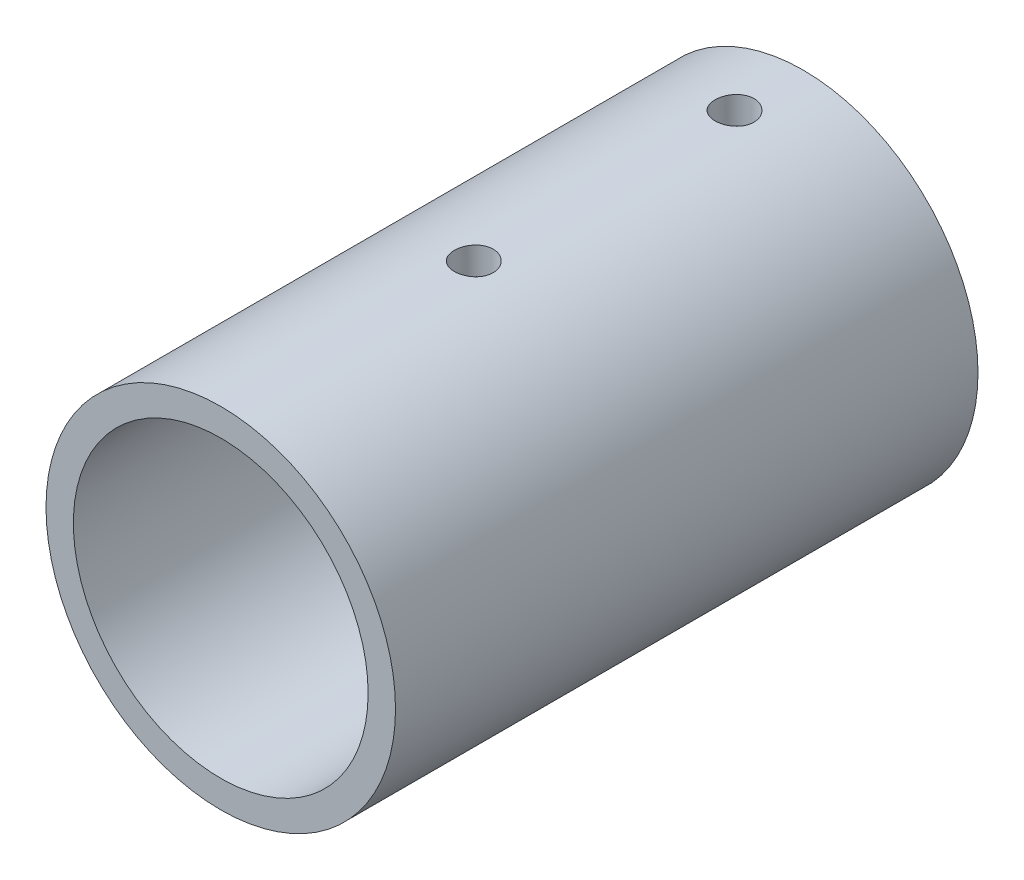
from build123d import *

# Parameters (mm, degrees)
SKETCH1_R               = 45
BOSS_EXTRUDE1_DEPTH     = 150
SKETCH2_R               = 31.85
CUT_EXTRUDE1_DEPTH      = 163.941707368
SKETCH3_R               = 37.95
CUT_EXTRUDE2_DEPTH      = 140
CUT_EXTRUDE5_DEPTH      = 163.941707368
CUT_EXTRUDE5_DEPTH_BACK = 163.941707368
SKETCH8_R               = 5


with BuildPart() as part:
    # Sketch1 → Boss-Extrude1 (new body)
    with BuildSketch(Plane.XY):
        Circle(SKETCH1_R)
    extrude(amount=BOSS_EXTRUDE1_DEPTH)

    # Sketch2 → Cut-Extrude1 (cut, through all)
    with BuildSketch(Plane.XY.offset(150)):
        Circle(SKETCH2_R)
    extrude(amount=-CUT_EXTRUDE1_DEPTH, mode=Mode.SUBTRACT)

    # Sketch3 → Cut-Extrude2 (cut)
    with BuildSketch(Plane.XY.offset(150)):
        Circle(SKETCH3_R)
    extrude(amount=-CUT_EXTRUDE2_DEPTH, mode=Mode.SUBTRACT)

    # Sketch8 → Cut-Extrude5 (cut, two sides: drawn at the far end of the back side and taken through both)
    with BuildSketch(Plane(origin=(0, 0, 0), x_dir=(1, 0, 0), z_dir=(0, 1, 0)).offset(-CUT_EXTRUDE5_DEPTH_BACK)):
        with Locations(Location((0, -17.7, 0), (0, 0, 270))):
            Circle(SKETCH8_R)
        with Locations(Location((0, -84.85, 0), (0, 0, 270))):
            Circle(SKETCH8_R)
    extrude(amount=CUT_EXTRUDE5_DEPTH + CUT_EXTRUDE5_DEPTH_BACK, mode=Mode.SUBTRACT)


solid = part.part
